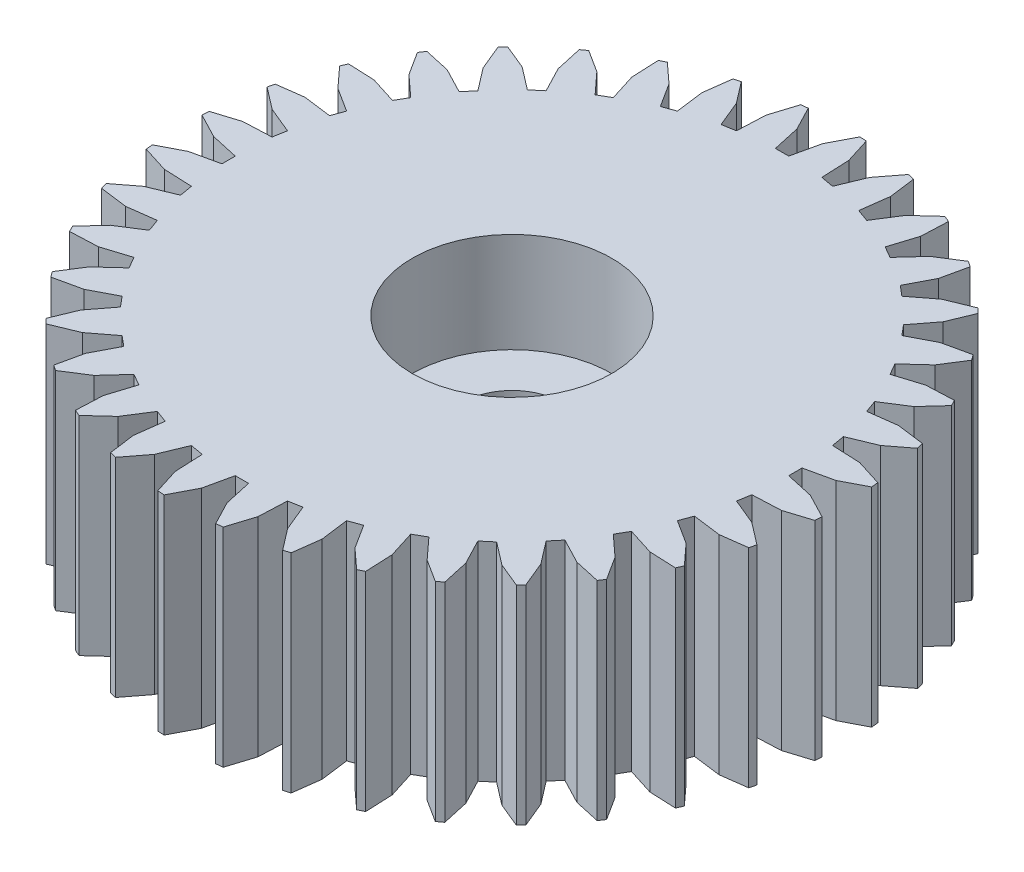
from build123d import *

# Parameters (mm, degrees)
SKETCH1_R           = 10.0584
BOSS_EXTRUDE1_DEPTH = 6.35
SKETCH2_R           = 1.524
CUT_EXTRUDE1_DEPTH  = 16.577718739
SKETCH3_R           = 3.048
CUT_EXTRUDE2_DEPTH  = 3.048
CUT_EXTRUDE3_DEPTH  = 16.577718739
CIRPATTERN1_COUNT   = 36


with BuildPart() as part:
    # Sketch1 → Boss-Extrude1 (new body)
    with BuildSketch(Plane(origin=(0, 0, 0), x_dir=(1, 0, 0), z_dir=(0, 1, 0))):
        with Locations(Location((0, 0, 0), (0, 0, 270))):
            Circle(SKETCH1_R)
    extrude(amount=BOSS_EXTRUDE1_DEPTH)

    # Sketch2 → Cut-Extrude1 (cut, through all)
    with BuildSketch(Plane(origin=(0, 6.35, 0), x_dir=(1, 0, 0), z_dir=(0, 1, 0))):
        with Locations(Location((0, 0, 0), (0, 0, 270))):
            Circle(SKETCH2_R)
    extrude(amount=-CUT_EXTRUDE1_DEPTH, mode=Mode.SUBTRACT)

    # Sketch3 → Cut-Extrude2 (cut)
    with BuildSketch(Plane(origin=(0, 6.35, 0), x_dir=(1, 0, 0), z_dir=(0, 1, 0))):
        with Locations(Location((0, 0, 0), (0, 0, 270))):
            Circle(SKETCH3_R)
    extrude(amount=-CUT_EXTRUDE2_DEPTH, mode=Mode.SUBTRACT)

    # Sketch4 → Cut-Extrude3 (cut, through all)
    with BuildSketch(Plane.XZ):
        Polygon((-26.806716732, -59.6465888), (-0.992739546, -10.0584), (-0.593526671, -9.291519201), (-0.4064, -8.447445337), (0, -8.447445337), (0.187126671, -9.291519201), (0.586339546, -10.0584), (26.400316732, -59.6465888), (26.400316732, -171.456246463), (-26.806716732, -171.456246463), align=None)
    cut_extrude3 = extrude(amount=-CUT_EXTRUDE3_DEPTH, mode=Mode.SUBTRACT)

    # CirPattern1: Cut-Extrude3 ×36 about axis
    cirpattern1_axis = Axis((0, 0, 0), (0, 1, 0))
    for i in range(1, CIRPATTERN1_COUNT):
        add(cut_extrude3.rotate(cirpattern1_axis, i * 360 / CIRPATTERN1_COUNT), mode=Mode.SUBTRACT)


solid = part.part
